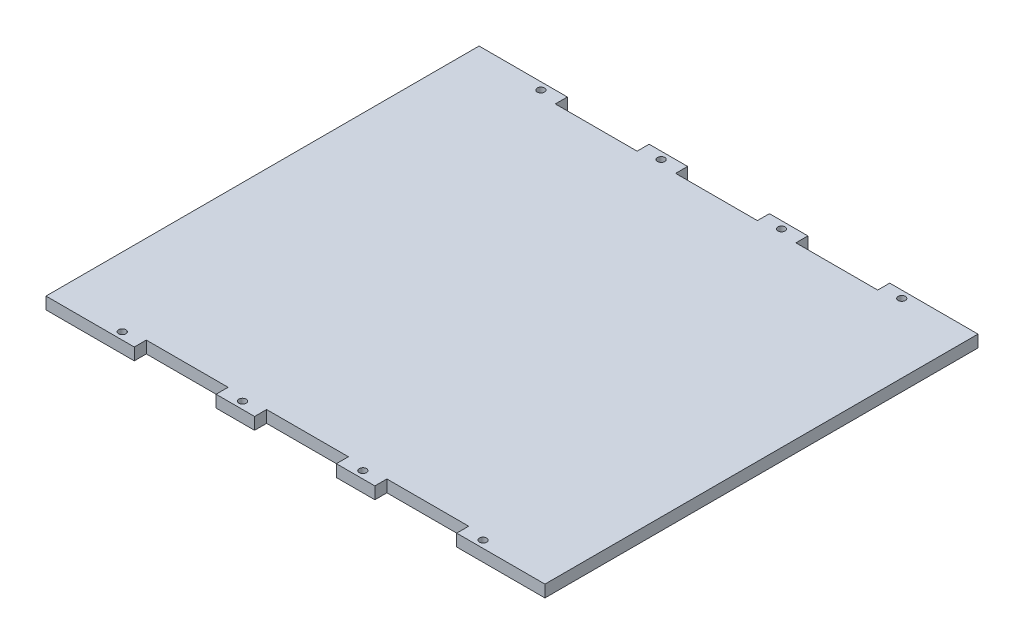
from build123d import *

# Parameters (mm, degrees)
CROQUIS1_W                  = 200
CROQUIS1_H                  = 180
SALIENTE_EXTRUIR1_DEPTH     = 5
CROQUIS4_W                  = 17
CROQUIS4_H                  = 5
CROQUIS4_W_2                = 34
CORTAR_EXTRUIR4_DEPTH       = 135.629120178
SIMETR_A3_COPY_1_SKETCH_W   = 17
SIMETR_A3_COPY_1_SKETCH_H   = 5
SIMETR_A3_COPY_1_SKETCH_W_2 = 34
SIMETR_A3_COPY_1_DEPTH      = 135.629120178
CROQUIS5_R                  = 1.5
CORTAR_EXTRUIR5_DEPTH       = 135.629120178
CROQUIS6_W                  = 17
CROQUIS6_H                  = 5
SALIENTE_EXTRUIR3_DEPTH     = 5
SIMETR_A6_COPY_1_SKETCH_W   = 17
SIMETR_A6_COPY_1_SKETCH_H   = 5
SIMETR_A6_COPY_1_DEPTH      = 5
CROQUIS9_W                  = 3.69
CROQUIS9_H                  = 180
SALIENTE_EXTRUIR7_DEPTH     = 5


with BuildPart() as part:
    # Croquis1 → Saliente-Extruir1 (new body)
    with BuildSketch(Plane(origin=(0, 0, 0), x_dir=(1, 0, 0), z_dir=(0, 1, 0))):
        Rectangle(CROQUIS1_W, CROQUIS1_H)
    extrude(amount=SALIENTE_EXTRUIR1_DEPTH)

    # Croquis4 → Cortar-Extruir4 (cut, through all)
    with BuildSketch(Plane(origin=(0, 5, 0), x_dir=(1, 0, 0), z_dir=(0, 1, 0))):
        with Locations((-91.5, -87.5)):
            Rectangle(CROQUIS4_W, CROQUIS4_H)
        with Locations((-50, -87.5)):
            Rectangle(CROQUIS4_W_2, CROQUIS4_H)
        with Locations((-8.5, -87.5)):
            Rectangle(CROQUIS4_W, CROQUIS4_H)
    cortar_extruir4 = extrude(amount=-CORTAR_EXTRUIR4_DEPTH, mode=Mode.SUBTRACT)

    # Simetría2: Cortar-Extruir4 across plane
    add(cortar_extruir4.mirror(Plane(origin=(0, 0, 0), x_dir=(0, 0, 1), z_dir=(1, 0, 0))), mode=Mode.SUBTRACT)

    # Simetría3: Cortar-Extruir4 across plane
    add(cortar_extruir4.mirror(Plane.XY), mode=Mode.SUBTRACT)

    # Simetría3 copy 1 sketch → Simetría3 copy 1 (cut, through all)
    with BuildSketch(Plane(origin=(0, 5, 0), x_dir=(-1, 0, 0), z_dir=(0, 1, 0))):
        with Locations((-91.5, -87.5)):
            Rectangle(SIMETR_A3_COPY_1_SKETCH_W, SIMETR_A3_COPY_1_SKETCH_H)
        with Locations((-50, -87.5)):
            Rectangle(SIMETR_A3_COPY_1_SKETCH_W_2, SIMETR_A3_COPY_1_SKETCH_H)
        with Locations((-8.5, -87.5)):
            Rectangle(SIMETR_A3_COPY_1_SKETCH_W, SIMETR_A3_COPY_1_SKETCH_H)
    extrude(amount=-SIMETR_A3_COPY_1_DEPTH, mode=Mode.SUBTRACT)

    # Croquis5 → Cortar-Extruir5 (cut, through all)
    with BuildSketch(Plane(origin=(0, 5, 0), x_dir=(1, 0, 0), z_dir=(0, 1, 0))):
        with Locations(Location((-75, -87, 0), (0, 0, 270))):
            Circle(CROQUIS5_R)
        with Locations(Location((-25, -87, 0), (0, 0, 270))):
            Circle(CROQUIS5_R)
        with Locations(Location((25, -87, 0), (0, 0, 270))):
            Circle(CROQUIS5_R)
        with Locations(Location((75, -87, 0), (0, 0, 270))):
            Circle(CROQUIS5_R)
    cortar_extruir5 = extrude(amount=-CORTAR_EXTRUIR5_DEPTH, mode=Mode.SUBTRACT)

    # Simetría4: Cortar-Extruir5 across plane
    add(cortar_extruir5.mirror(Plane.XY), mode=Mode.SUBTRACT)

    # Croquis6 → Saliente-Extruir3 (add, through all)
    with BuildSketch(Plane(origin=(0, 5, 0), x_dir=(1, 0, 0), z_dir=(0, 1, 0))):
        with Locations((91.5, 87.5)):
            Rectangle(CROQUIS6_W, CROQUIS6_H)
    saliente_extruir3 = extrude(amount=-SALIENTE_EXTRUIR3_DEPTH)

    # Simetría5: Saliente-Extruir3 across plane
    add(saliente_extruir3.mirror(Plane(origin=(0, 0, 0), x_dir=(0, 0, 1), z_dir=(1, 0, 0))))

    # Simetría6: Saliente-Extruir3 across plane
    add(saliente_extruir3.mirror(Plane.XY))

    # Simetría6 copy 1 sketch → Simetría6 copy 1 (add, through all)
    with BuildSketch(Plane(origin=(0, 5, 0), x_dir=(-1, 0, 0), z_dir=(0, 1, 0))):
        with Locations((91.5, 87.5)):
            Rectangle(SIMETR_A6_COPY_1_SKETCH_W, SIMETR_A6_COPY_1_SKETCH_H)
    extrude(amount=-SIMETR_A6_COPY_1_DEPTH)

    # Croquis9 → Saliente-Extruir7 (add)
    with BuildSketch(Plane(origin=(0, 5, 0), x_dir=(1, 0, 0), z_dir=(0, 1, 0))):
        with Locations((101.845, 0)):
            Rectangle(CROQUIS9_W, CROQUIS9_H)
    saliente_extruir7 = extrude(amount=-SALIENTE_EXTRUIR7_DEPTH)

    # Simetría7: Saliente-Extruir7 across plane
    add(saliente_extruir7.mirror(Plane(origin=(0, 0, 0), x_dir=(0, 0, 1), z_dir=(1, 0, 0))))


solid = part.part
